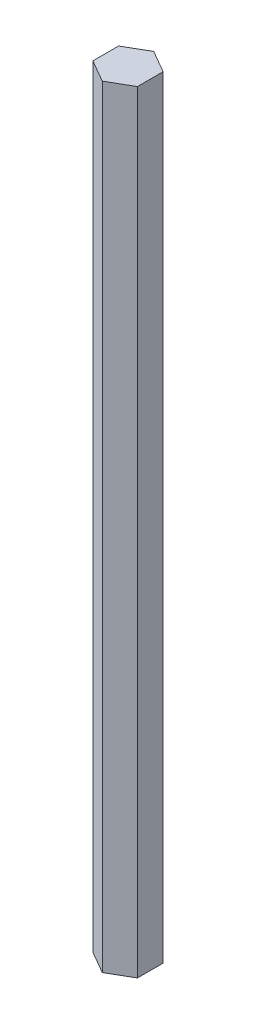
from build123d import *

# Parameters (mm, degrees)
BOSS_EXTRUDE1_DEPTH = 165.1


with BuildPart() as part:
    # Sketch1 → Boss-Extrude1 (new body)
    with BuildSketch(Plane(origin=(0, 0, 0), x_dir=(1, 0, 0), z_dir=(0, 1, 0))):
        Polygon((0, 4.704923569), (-4.7625, 1.955292912), (-4.7625, -3.543968402), (0, -6.293599059), (4.7625, -3.543968402), (4.7625, 1.955292912), align=None)
    extrude(amount=BOSS_EXTRUDE1_DEPTH)


solid = part.part
